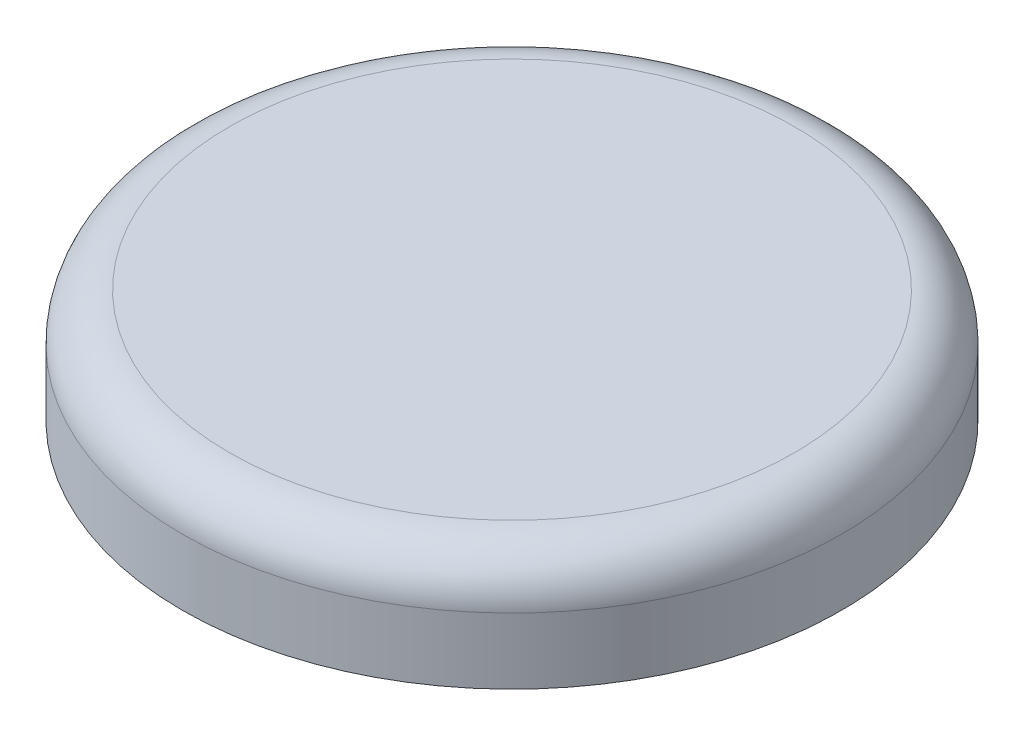
from build123d import *

# Parameters (mm, degrees)
SKETCH_1_R          = 35
EXTRUDE_1_DEPTH     = 12
CUT_EXTRUDE_1_DEPTH = 4
SKETCH_3_R          = 2
CUT_EXTRUDE_2_DEPTH = 5
FILLET_1_R          = 5
SKETCH_4_R          = 20
CUT_EXTRUDE_3_DEPTH = 10
FILLET_2_R          = 5
SKETCH_5_R          = 23.6
CUT_EXTRUDE_4_DEPTH = 2.3


with BuildPart() as part:
    # 草图1 → 凸台-拉伸1 (new body)
    with BuildSketch(Plane(origin=(0, 0, 0), x_dir=(1, 0, 0), z_dir=(0, 1, 0))):
        with Locations(Location((0, 0, 0), (0, 0, 270))):
            Circle(SKETCH_1_R)
    extrude(amount=EXTRUDE_1_DEPTH)

    # 草图2 → 切除-拉伸1 (cut)
    with BuildSketch(Plane.XZ):
        Polygon((-18.2, -27.250932706), (-14.5, -29.387128702), (-10.8, -27.250932706), (-10.8, -22.978540714), (-14.5, -20.842344718), (-18.2, -22.978540714), align=None)
        Polygon((32.7, -2.136195996), (32.7, 2.136195996), (29, 4.272391992), (25.3, 2.136195996), (25.3, -2.136195996), (29, -4.272391992), align=None)
        Polygon((-14.5, 29.387128702), (-18.2, 27.250932706), (-18.2, 22.978540714), (-14.5, 20.842344718), (-10.8, 22.978540714), (-10.8, 27.250932706), align=None)
    extrude(amount=-CUT_EXTRUDE_1_DEPTH, mode=Mode.SUBTRACT)

    # 草图3 → 切除-拉伸2 (cut)
    with BuildSketch(Plane.XZ.offset(-4)):
        with Locations(Location((29, 0, 0), (0, 0, 270))):
            Circle(SKETCH_3_R)
        with Locations(Location((-14.5, -25.11473671, 0), (0, 0, 270))):
            Circle(SKETCH_3_R)
        with Locations(Location((-14.5, 25.11473671, 0), (0, 0, 270))):
            Circle(SKETCH_3_R)
    extrude(amount=-CUT_EXTRUDE_2_DEPTH, mode=Mode.SUBTRACT)

    # 圆角1
    fillet_1_edges = [part.edges().sort_by_distance(p)[0] for p in [
        (0, 12, -35),
    ]]
    fillet(fillet_1_edges, radius=FILLET_1_R)

    # 草图4 → 切除-拉伸3 (cut)
    with BuildSketch(Plane.XZ):
        with Locations(Location((0, 0, 0), (0, 0, 270))):
            Circle(SKETCH_4_R)
    extrude(amount=-CUT_EXTRUDE_3_DEPTH, mode=Mode.SUBTRACT)

    # 圆角2
    fillet_2_edges = [part.edges().sort_by_distance(p)[0] for p in [
        (0, 10, 20),
    ]]
    fillet(fillet_2_edges, radius=FILLET_2_R)

    # 草图5 → 切除-拉伸4 (cut)
    with BuildSketch(Plane.XZ):
        with Locations(Location((0, 0, 0), (0, 0, 270))):
            Circle(SKETCH_5_R)
    extrude(amount=-CUT_EXTRUDE_4_DEPTH, mode=Mode.SUBTRACT)


solid = part.part
